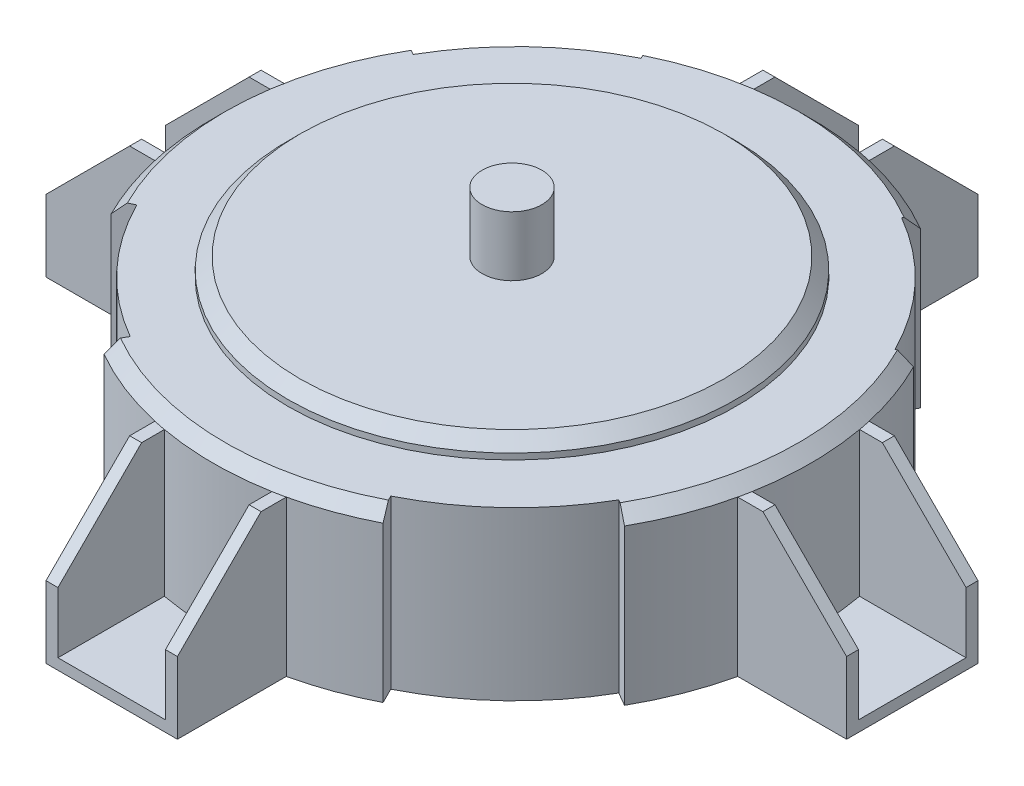
from build123d import *

# Parameters (mm, degrees)
SKETCH1_R           = 50
BOSS_EXTRUDE1_DEPTH = 28
SKETCH2_R           = 37.5
BOSS_EXTRUDE2_DEPTH = 3
CHAMFER1_SIZE       = 2
SKETCH3_R           = 5
BOSS_EXTRUDE3_DEPTH = 10
BOSS_EXTRUDE4_DEPTH = 67
CIRPATTERN6_COUNT   = 4
CHAMFER2_SIZE       = 14
CUT_EXTRUDE1_DEPTH  = 67
CIRPATTERN7_COUNT   = 4


with BuildPart() as part:
    # Sketch1 → Boss-Extrude1 (new body)
    with BuildSketch(Plane(origin=(0, 0, 0), x_dir=(1, 0, 0), z_dir=(0, 1, 0))):
        with Locations(Location((0, 0, 0), (0, 0, 270))):
            Circle(SKETCH1_R)
    extrude(amount=BOSS_EXTRUDE1_DEPTH)

    # Sketch2 → Boss-Extrude2 (add)
    with BuildSketch(Plane(origin=(0, 28, 0), x_dir=(1, 0, 0), z_dir=(0, 1, 0))):
        with Locations(Location((0, 0, 0), (0, 0, 270))):
            Circle(SKETCH2_R)
    extrude(amount=BOSS_EXTRUDE2_DEPTH)

    # Chamfer1
    chamfer1_edges = [part.edges().sort_by_distance(p)[0] for p in [
        (0, 28, -50),
        (0, 31, -37.5),
    ]]
    chamfer(chamfer1_edges, length=CHAMFER1_SIZE)

    # Sketch3 → Boss-Extrude3 (add)
    with BuildSketch(Plane(origin=(0, 31, 0), x_dir=(1, 0, 0), z_dir=(0, 1, 0))):
        with Locations(Location((0, 0, 0), (0, 0, 270))):
            Circle(SKETCH3_R)
    extrude(amount=BOSS_EXTRUDE3_DEPTH)

    # Sketch4 → Boss-Extrude4 (add)
    with BuildSketch(Plane.XY):
        Polygon((-8.998295996, 1.823065443), (8.998295996, 1.823065443), (8.998295996, 26), (10.998295996, 26), (10.998295996, 0), (-10.998295996, 0), (-10.998295996, 26), (-8.998295996, 26), align=None)
    boss_extrude4 = extrude(amount=-BOSS_EXTRUDE4_DEPTH)

    # CirPattern6: Boss-Extrude4 ×4 about axis
    cirpattern6_axis = Axis((0, 0, 0), (0, 1, 0))
    for i in range(1, CIRPATTERN6_COUNT):
        add(boss_extrude4.rotate(cirpattern6_axis, i * 360 / CIRPATTERN6_COUNT))

    # Chamfer2
    chamfer2_edges = [part.edges().sort_by_distance(p)[0] for p in [
        (9.998295996, 26, -67),
        (-9.998295996, 26, -67),
        (-67, 26, -9.998295996),
        (-9.998295996, 26, 67),
        (-67, 26, 9.998295996),
        (67, 26, 9.998295996),
        (67, 26, -9.998295996),
        (9.998295996, 26, 67),
    ]]
    chamfer(chamfer2_edges, length=CHAMFER2_SIZE)

    # Sketch10 → Cut-Extrude1 (cut)
    with BuildSketch(Plane(origin=(0, 0, 0), x_dir=(-1, 0, 0), z_dir=(0, -1, 0))):
        with BuildLine():
            Line((24.931942454, -43.340491985), (23.336298137, -40.566700498))
            ThreePointArc((23.336298137, -40.566700498), (34.044117933, -32.112895139), (41.858905353, -20.930170631))
            Line((41.858905353, -20.930170631), (44.721052728, -22.361293409))
            ThreePointArc((44.721052728, -22.361293409), (36.371920868, -34.308648652), (24.931942454, -43.340491985))
        make_face()
    cut_extrude1 = extrude(amount=-CUT_EXTRUDE1_DEPTH, mode=Mode.SUBTRACT)

    # CirPattern7: Cut-Extrude1 ×4 about axis
    cirpattern7_axis = Axis((0.338512389, 0, -0.319309576), (0, 1, 0))
    for i in range(1, CIRPATTERN7_COUNT):
        add(cut_extrude1.rotate(cirpattern7_axis, i * 360 / CIRPATTERN7_COUNT), mode=Mode.SUBTRACT)


solid = part.part
